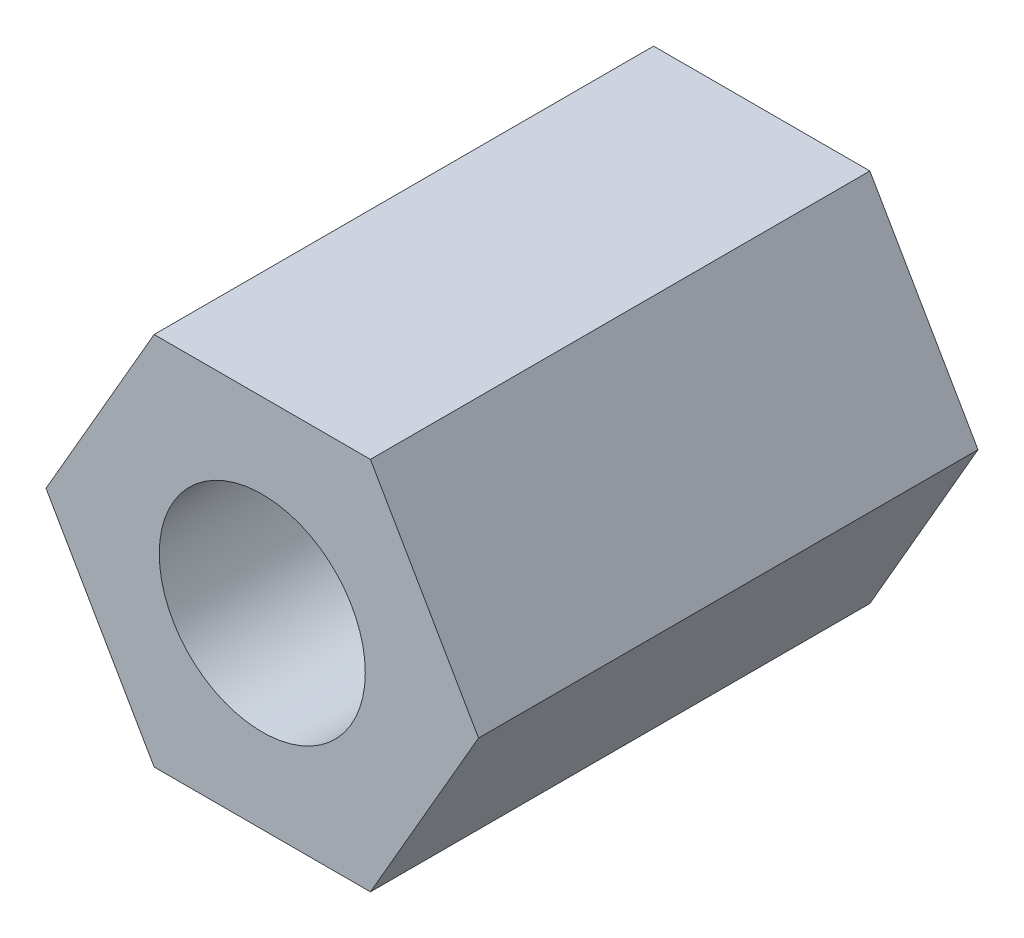
from build123d import *

# Parameters (mm, degrees)
EXTRUDE_1_DEPTH              = 8
HOLE_WIZARD_M4_1_D           = 3.3
HOLE_WIZARD_M4_1_CSINK_D     = 4.05
HOLE_WIZARD_M4_1_CSINK_ANGLE = 90


with BuildPart() as part:
    # 草图1 → 凸台-拉伸1 (new body)
    with BuildSketch(Plane.XY):
        Polygon((3.464101615, 0), (1.732050808, 3), (-1.732050808, 3), (-3.464101615, 0), (-1.732050808, -3), (1.732050808, -3), align=None)
    extrude(amount=EXTRUDE_1_DEPTH)

    # M4 螺纹孔1 (through all)
    with Locations(Plane(origin=(0, 0, 0), x_dir=(-1, 0, 0), z_dir=(0, 0, -1))):
        with Locations((0, 0)):
            CounterSinkHole(HOLE_WIZARD_M4_1_D / 2, HOLE_WIZARD_M4_1_CSINK_D / 2, counter_sink_angle=HOLE_WIZARD_M4_1_CSINK_ANGLE)


solid = part.part
